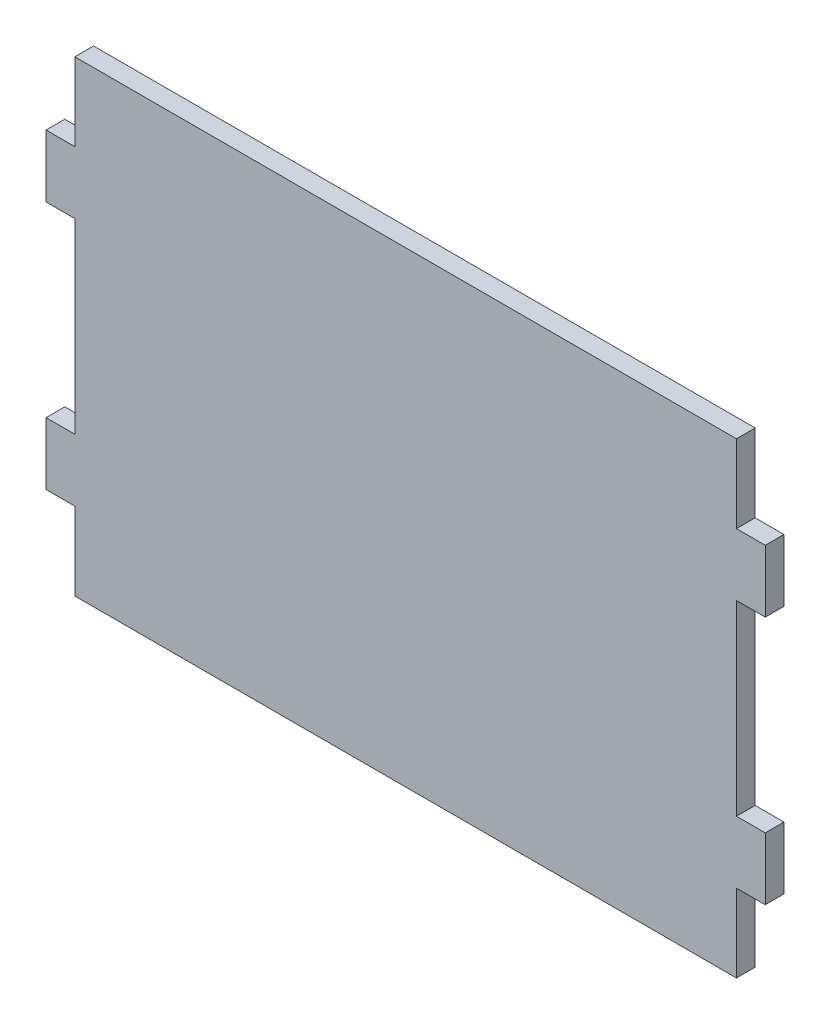
from build123d import *

# Parameters (mm, degrees)
SKETCH1_W           = 18.5
SKETCH1_H           = 40
BOSS_EXTRUDE1_DEPTH = 12


with BuildPart() as part:
    # Sketch1 → Boss-Extrude1 (new body)
    with BuildSketch(Plane.XY):
        Polygon((-212.5, -100), (-212.5, -150), (212.5, -150), (212.5, -100), (212.5, -60), (212.5, 60), (212.5, 100), (212.5, 150), (-212.5, 150), (-212.5, 100), (-212.5, 60), (-212.5, -60), align=None)
        with Locations((-221.75, -80)):
            Rectangle(SKETCH1_W, SKETCH1_H)
        with Locations((-221.75, 80)):
            Rectangle(SKETCH1_W, SKETCH1_H)
        with Locations((221.75, 80)):
            Rectangle(SKETCH1_W, SKETCH1_H)
        with Locations((221.75, -80)):
            Rectangle(SKETCH1_W, SKETCH1_H)
    extrude(amount=BOSS_EXTRUDE1_DEPTH)


solid = part.part
